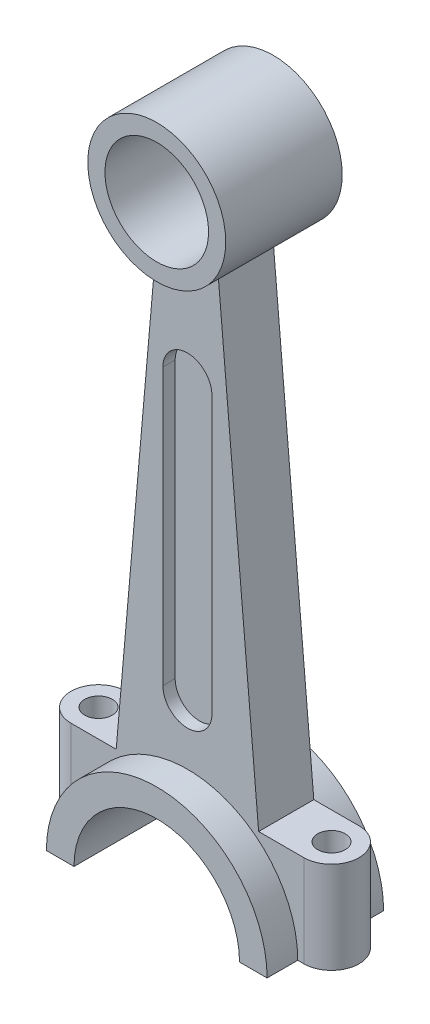
from build123d import *

# Parameters (mm, degrees)
SKETCH2_R             = 22.5
SKETCH2_R_2           = 16.9
BOSS_EXTRUDE1_DEPTH   = 19
SKETCH2_R_3           = 36
SKETCH2_R_4           = 27
BOSS_EXTRUDE1_2_DEPTH = 19
BOSS_EXTRUDE2_DEPTH   = 9
CUT_EXTRUDE1_DEPTH    = 4
CUT_EXTRUDE2_DEPTH    = 99
BOSS_EXTRUDE3_DEPTH   = 30
CUT_EXTRUDE3_START    = -99
SKETCH6_R             = 27
CUT_EXTRUDE3_DEPTH    = 99
SKETCH7_R             = 4.5
CUT_EXTRUDE4_DEPTH    = 99


with BuildPart() as part:
    # Sketch2 → Boss-Extrude1 (new, symmetric)
    with BuildSketch(Plane.XY):
        Circle(SKETCH2_R)
        Circle(SKETCH2_R_2, mode=Mode.SUBTRACT)
    extrude(amount=BOSS_EXTRUDE1_DEPTH, both=True)



with BuildPart() as body_2:
    # Sketch2 → Boss-Extrude1 2 (new, symmetric)
    with BuildSketch(Plane.XY):
        with Locations((0, -201.2)):
            Circle(SKETCH2_R_3)
        with Locations((0, -201.2)):
            Circle(SKETCH2_R_4, mode=Mode.SUBTRACT)
    extrude(amount=BOSS_EXTRUDE1_2_DEPTH, both=True)


with BuildPart() as part_1:
    add(part.part)

    add(body_2.part)  # Boss-Extrude2 merges body 2
    # Sketch2<5> → Boss-Extrude2 (add, symmetric)
    with BuildSketch(Plane.XY):
        with BuildLine():
            Line((0, -165.2), (0, -22.5))
            ThreePointArc((0, -22.5), (-5.135562367, -21.906072199), (-10, -20.155644371))
            Line((-10, -20.155644371), (-23.469590176, -173.902045187))
            ThreePointArc((-23.469590176, -173.902045187), (-12.515462971, -167.445545677), (0, -165.2))
        make_face()
        with BuildLine():
            ThreePointArc((10, -20.155644371), (5.135562367, -21.906072199), (0, -22.5))
            Line((0, -22.5), (0, -165.2))
            ThreePointArc((0, -165.2), (12.515462971, -167.445545677), (23.469590176, -173.902045187))
            Line((23.469590176, -173.902045187), (10, -20.155644371))
        make_face()
    extrude(amount=BOSS_EXTRUDE2_DEPTH, both=True)

    # Sketch3 → Cut-Extrude1 (cut)
    with BuildSketch(Plane.XY.offset(9)):
        with BuildLine():
            Line((8, -55.6), (8, -145.6))
            ThreePointArc((8, -145.6), (0, -153.6), (-8, -145.6))
            Line((-8, -145.6), (-8, -55.6))
            ThreePointArc((-8, -55.6), (0, -47.6), (8, -55.6))
        make_face()
    cut_extrude1 = extrude(amount=-CUT_EXTRUDE1_DEPTH, mode=Mode.SUBTRACT)

    # Mirror1: Cut-Extrude1 across plane
    add(cut_extrude1.mirror(Plane.XY), mode=Mode.SUBTRACT)

    # Sketch4 → Cut-Extrude2 (cut)
    with BuildSketch(Plane.XY.offset(19)):
        Polygon((0, -201.2), (-54.705364776, -201.2), (-51.550648926, -248.976612299), (37.861738866, -255.19137468), (50.544643276, -201.2), align=None)
    extrude(amount=-CUT_EXTRUDE2_DEPTH, mode=Mode.SUBTRACT)

    # Sketch5 → Boss-Extrude3 (add)
    with BuildSketch(Plane(origin=(0, -171.2, 0), x_dir=(-1, 0, 0), z_dir=(0, -1, 0))):
        with BuildLine():
            Line((38, -9), (-38, -9))
            ThreePointArc((-38, -9), (-47, 0), (-38, 9))
            Line((-38, 9), (38, 9))
            ThreePointArc((38, 9), (47, 0), (38, -9))
        make_face()
    extrude(amount=BOSS_EXTRUDE3_DEPTH)

    # Sketch6 → Cut-Extrude3 (cut)
    with BuildSketch(Plane.XY.offset(9).offset(CUT_EXTRUDE3_START)):
        with Locations((0, -201.2)):
            Circle(SKETCH6_R)
    extrude(amount=CUT_EXTRUDE3_DEPTH, mode=Mode.SUBTRACT)

    # Sketch7 → Cut-Extrude4 (cut)
    with BuildSketch(Plane(origin=(0, -171.2, 0), x_dir=(1, 0, 0), z_dir=(0, 1, 0))):
        with Locations(Location((38, 0, 0), (0, 0, 270))):
            Circle(SKETCH7_R)
    cut_extrude4 = extrude(amount=-CUT_EXTRUDE4_DEPTH, mode=Mode.SUBTRACT)

    # Mirror2: Cut-Extrude4 across plane
    add(cut_extrude4.mirror(Plane(origin=(0, 0, 0), x_dir=(0, 0, 1), z_dir=(1, 0, 0))), mode=Mode.SUBTRACT)


solid = part_1.part
